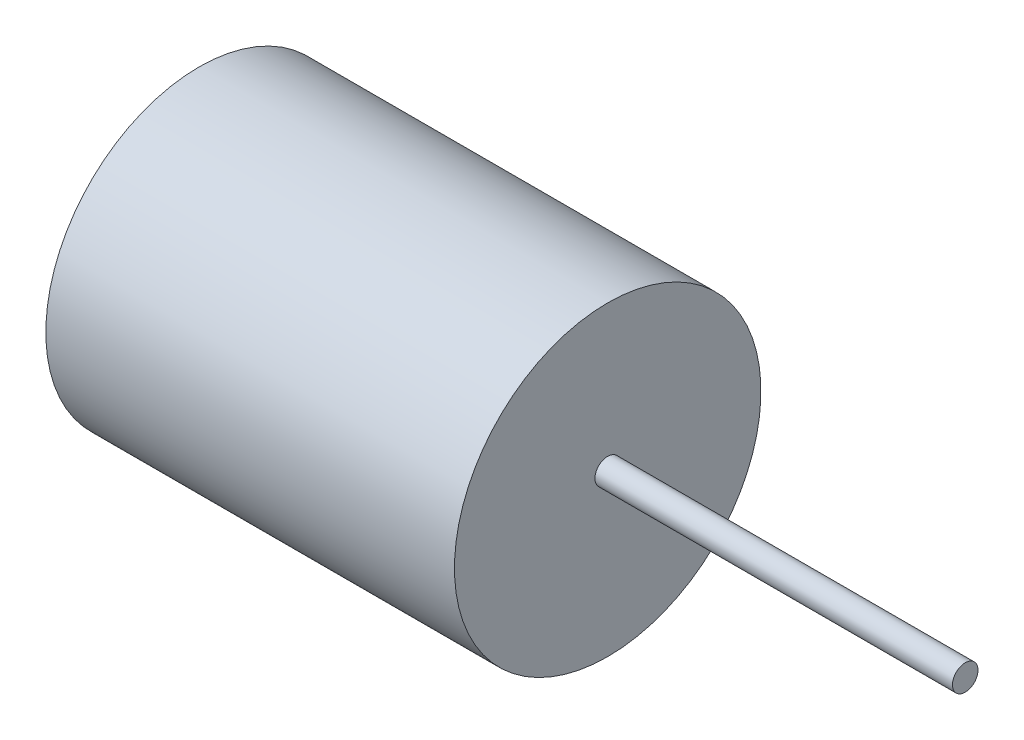
from build123d import *

# Parameters (mm, degrees)
SKETCH2_W           = 80
SKETCH2_H           = 30
SKETCH3_R           = 2.5
BOSS_EXTRUDE1_DEPTH = 70


with BuildPart() as part:
    # Sketch2 → Revolve1 (revolve)
    with BuildSketch(Plane.XY):
        with Locations((-8.516171329, 13.522727273)):
            Rectangle(SKETCH2_W, SKETCH2_H)
    revolve(axis=Axis((31.483828671, -1.477272727, 0), (-1, 0, 0)))

    # Sketch3 → Boss-Extrude1 (add)
    with BuildSketch(Plane(origin=(31.483828671, 0, 0), x_dir=(0, 0, -1), z_dir=(1, 0, 0))):
        with Locations(Location((0, 0, 0), (0, 0, 90))):
            Circle(SKETCH3_R)
    extrude(amount=BOSS_EXTRUDE1_DEPTH)


solid = part.part
